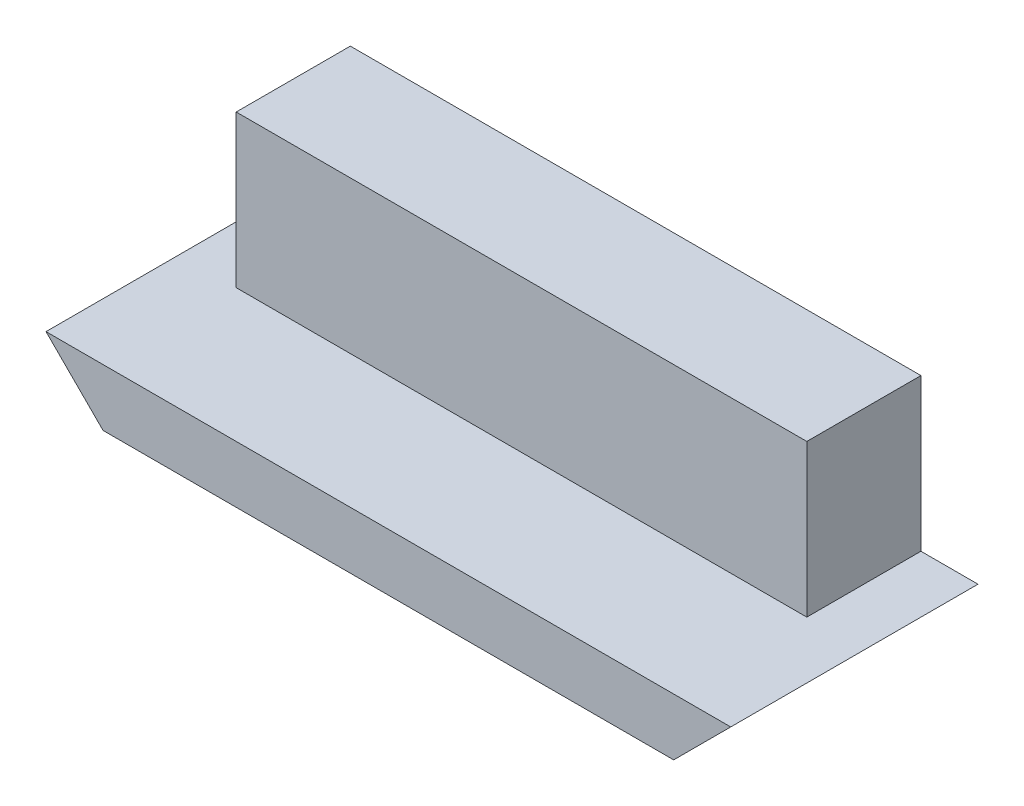
from build123d import *

# Parameters (mm, degrees)
BOSS_EXTRUDE1_DEPTH = 6.5
SKETCH2_W           = 15
SKETCH2_H           = 4
CUT_EXTRUDE1_DEPTH  = 3.5


with BuildPart() as part:
    # Sketch1 → Boss-Extrude1 (new body)
    with BuildSketch(Plane.XY):
        Polygon((0, 0), (-1.5, 1.5), (0, 1.5), (0, 5.5), (15, 5.5), (15, 1.5), (16.5, 1.5), (15, 0), align=None)
    extrude(amount=BOSS_EXTRUDE1_DEPTH)

    # Sketch2 → Cut-Extrude1 (cut)
    with BuildSketch(Plane.XY.offset(6.5)):
        with Locations((7.5, 3.5)):
            Rectangle(SKETCH2_W, SKETCH2_H)
    extrude(amount=-CUT_EXTRUDE1_DEPTH, mode=Mode.SUBTRACT)


solid = part.part
